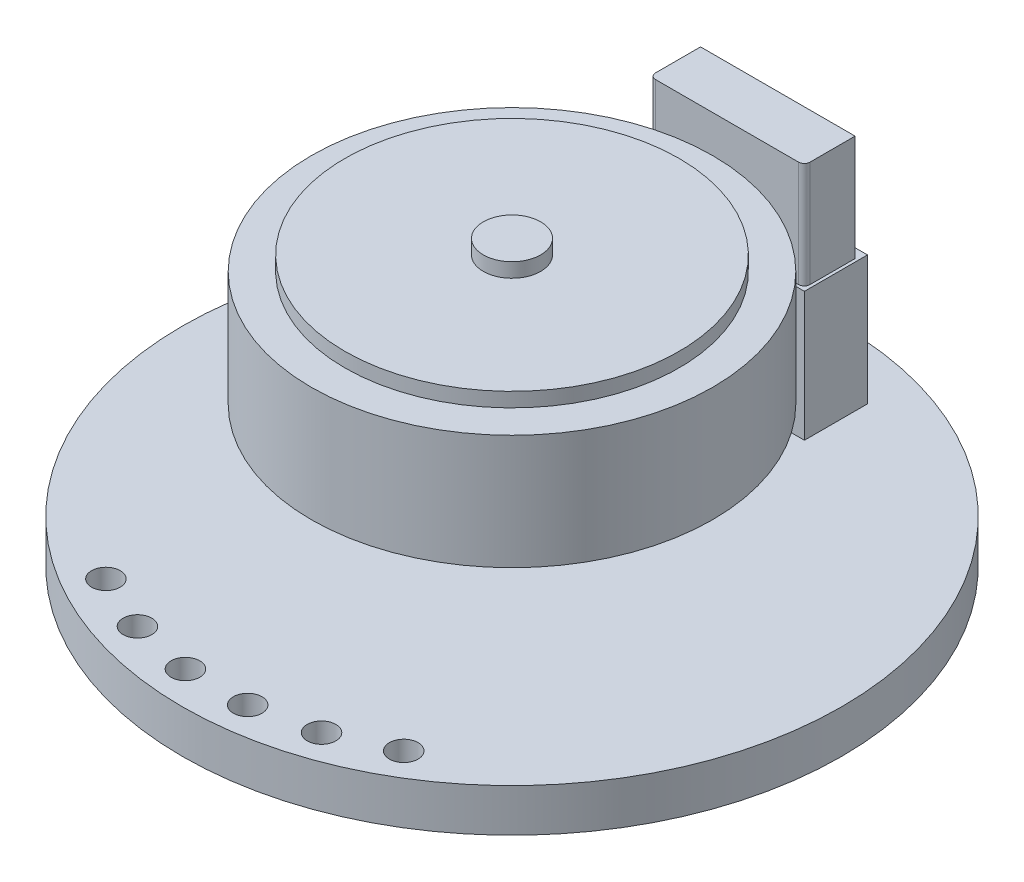
from build123d import *

# Parameters (mm, degrees)
ESBO_O1_R                = 11.5
RESSALTO_EXTRUS_O1_DEPTH = 1.5
ESBO_O2_W                = 5.6
ESBO_O2_H                = 2.2
RESSALTO_EXTRUS_O2_DEPTH = 4.5
RESSALTO_EXTRUS_O3_DEPTH = 3.7
ESBO_O4_R                = 1
RESSALTO_EXTRUS_O4_DEPTH = 3.4
ESBO_O5_R                = 7
RESSALTO_EXTRUS_O5_DEPTH = 4
ESBO_O6_R                = 5.830002148
RESSALTO_EXTRUS_O6_DEPTH = 0.5
ESBO_O7_R                = 1
RESSALTO_EXTRUS_O7_DEPTH = 0.5
ESBO_O8_R                = 0.5
CORTE_EXTRUS_O1_DEPTH    = 19.304644219


with BuildPart() as part:
    # Esboço1 → Ressalto-extrusão1 (new body)
    with BuildSketch(Plane(origin=(0, 0, 0), x_dir=(1, 0, 0), z_dir=(0, 1, 0))):
        with Locations(Location((0, 0, 0), (0, 0, 270))):
            Circle(ESBO_O1_R)
    extrude(amount=RESSALTO_EXTRUS_O1_DEPTH)

    # Esboço2 → Ressalto-extrusão2 (add)
    with BuildSketch(Plane(origin=(0, 1.5, 0), x_dir=(1, 0, 0), z_dir=(0, 1, 0))):
        with Locations((0, 8.5)):
            Rectangle(ESBO_O2_W, ESBO_O2_H)
    extrude(amount=RESSALTO_EXTRUS_O2_DEPTH)

    # Esboço3 → Ressalto-extrusão3 (add)
    with BuildSketch(Plane(origin=(0, 6, 0), x_dir=(1, 0, 0), z_dir=(0, 1, 0))):
        with BuildLine():
            Line((-2.695146994, 9.271525864), (2.695146994, 9.271525864))
            Line((2.695146994, 9.271525864), (2.695146994, 7.7))
            ThreePointArc((2.695146994, 7.7), (2.63656835, 7.558578644), (2.495146994, 7.5))
            Line((2.495146994, 7.5), (-2.495146994, 7.5))
            ThreePointArc((-2.495146994, 7.5), (-2.63656835, 7.558578644), (-2.695146994, 7.7))
            Line((-2.695146994, 7.7), (-2.695146994, 9.271525864))
        make_face()
    extrude(amount=RESSALTO_EXTRUS_O3_DEPTH)

    # Esboço4 → Ressalto-extrusão4 (add)
    with BuildSketch(Plane(origin=(0, 1.5, 0), x_dir=(1, 0, 0), z_dir=(0, 1, 0))):
        with Locations(Location((0, 0, 0), (0, 0, 270))):
            Circle(ESBO_O4_R)
    extrude(amount=RESSALTO_EXTRUS_O4_DEPTH)

    # Esboço5 → Ressalto-extrusão5 (add)
    with BuildSketch(Plane(origin=(0, 4.9, 0), x_dir=(1, 0, 0), z_dir=(0, 1, 0))):
        with Locations(Location((0, 0, 0), (0, 0, 270))):
            Circle(ESBO_O5_R)
    extrude(amount=RESSALTO_EXTRUS_O5_DEPTH)

    # Esboço6 → Ressalto-extrusão6 (add)
    with BuildSketch(Plane(origin=(0, 8.9, 0), x_dir=(1, 0, 0), z_dir=(0, 1, 0))):
        with Locations(Location((0, 0, 0), (0, 0, 270))):
            Circle(ESBO_O6_R)
    extrude(amount=RESSALTO_EXTRUS_O6_DEPTH)

    # Esboço7 → Ressalto-extrusão7 (add)
    with BuildSketch(Plane(origin=(0, 9.4, 0), x_dir=(1, 0, 0), z_dir=(0, 1, 0))):
        with Locations(Location((0, 0, 0), (0, 0, 270))):
            Circle(ESBO_O7_R)
    extrude(amount=RESSALTO_EXTRUS_O7_DEPTH)

    # Esboço8 → Corte-extrusão1 (cut, through all)
    with BuildSketch(Plane(origin=(0, 1.5, 0), x_dir=(1, 0, 0), z_dir=(0, 1, 0))):
        with Locations(Location((5.194212024, -8.970404078, 0), (0, 0, 270))):
            Circle(ESBO_O8_R)
        with Locations(Location((3.210199576, -9.853743332, 0), (0, 0, 270))):
            Circle(ESBO_O8_R)
        with Locations(Location((1.085886001, -10.305280121, 0), (0, 0, 270))):
            Circle(ESBO_O8_R)
        with Locations(Location((-1.085886001, -10.305280121, 0), (0, 0, 270))):
            Circle(ESBO_O8_R)
        with Locations(Location((-3.210199576, -9.853743332, 0), (0, 0, 270))):
            Circle(ESBO_O8_R)
        with Locations(Location((-5.194212024, -8.970404078, 0), (0, 0, 270))):
            Circle(ESBO_O8_R)
    extrude(amount=-CORTE_EXTRUS_O1_DEPTH, mode=Mode.SUBTRACT)


solid = part.part
